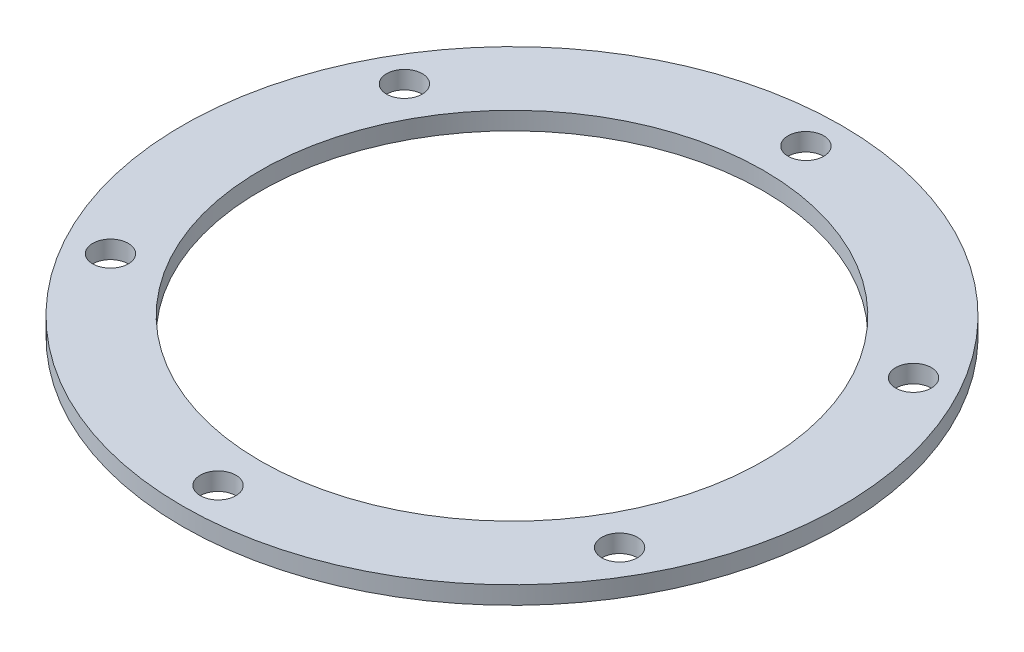
from build123d import *

# Parameters (mm, degrees)
SKETCH1_R           = 37
SKETCH1_R_2         = 28.25
SKETCH1_R_3         = 2
BOSS_EXTRUDE1_DEPTH = 2


with BuildPart() as part:
    # Sketch1 → Boss-Extrude1 (new body)
    with BuildSketch(Plane(origin=(0, 0, 0), x_dir=(1, 0, 0), z_dir=(0, 1, 0))):
        with Locations(Location((0, 0, 0), (0, 0, 270))):
            Circle(SKETCH1_R)
        with Locations(Location((0, 0, 0), (0, 0, 270))):
            Circle(SKETCH1_R_2, mode=Mode.SUBTRACT)
        with Locations(Location((0, 33, 0), (0, 0, 270))):
            Circle(SKETCH1_R_3, mode=Mode.SUBTRACT)
        with Locations(Location((28.578838325, 16.5, 0), (0, 0, 270))):
            Circle(SKETCH1_R_3, mode=Mode.SUBTRACT)
        with Locations(Location((28.578838325, -16.5, 0), (0, 0, 270))):
            Circle(SKETCH1_R_3, mode=Mode.SUBTRACT)
        with Locations(Location((0, -33, 0), (0, 0, 270))):
            Circle(SKETCH1_R_3, mode=Mode.SUBTRACT)
        with Locations(Location((-28.578838325, -16.5, 0), (0, 0, 270))):
            Circle(SKETCH1_R_3, mode=Mode.SUBTRACT)
        with Locations(Location((-28.578838325, 16.5, 0), (0, 0, 270))):
            Circle(SKETCH1_R_3, mode=Mode.SUBTRACT)
    extrude(amount=BOSS_EXTRUDE1_DEPTH)


solid = part.part
